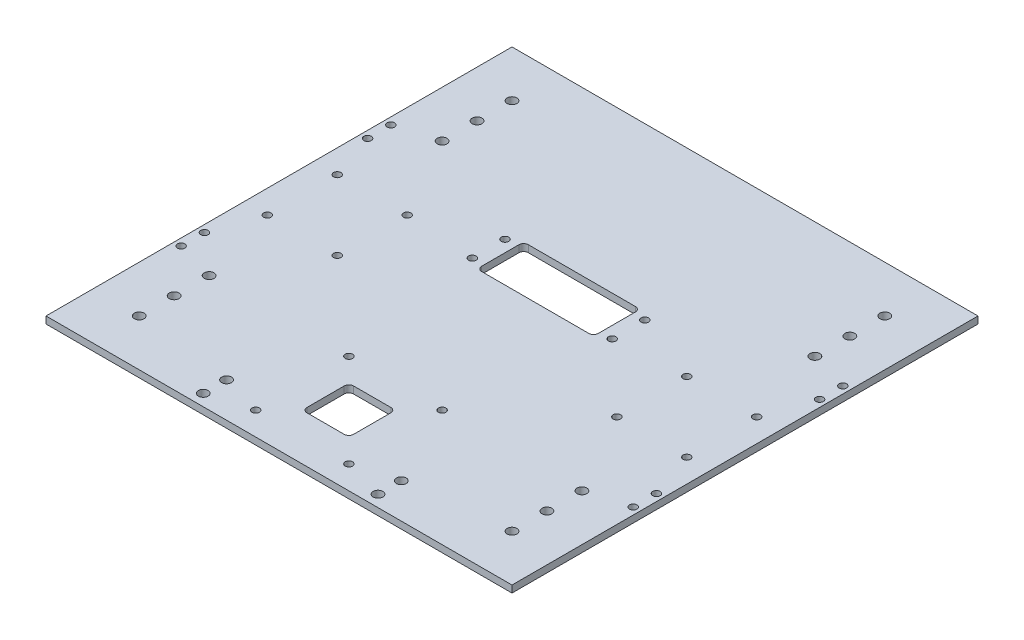
from build123d import *

# Parameters (mm, degrees)
SKETCH_1_W      = 200
SKETCH_1_H      = 200
SKETCH_1_R      = 1.6
SKETCH_1_R_2    = 2.1
EXTRUDE_1_DEPTH = 3


with BuildPart() as part:
    # 草图1 → 凸台-拉伸1 (new body)
    with BuildSketch(Plane(origin=(0, 0, 0), x_dir=(1, 0, 0), z_dir=(0, 1, 0))):
        Rectangle(SKETCH_1_W, SKETCH_1_H)
        with Locations(Location((-97, 35, 0), (0, 0, 270))):
            Circle(SKETCH_1_R, mode=Mode.SUBTRACT)
        with Locations(Location((-97, 45, 0), (0, 0, 270))):
            Circle(SKETCH_1_R, mode=Mode.SUBTRACT)
        with Locations(Location((-97, -45, 0), (0, 0, 90))):
            Circle(SKETCH_1_R, mode=Mode.SUBTRACT)
        with Locations(Location((-97, -35, 0), (0, 0, 90))):
            Circle(SKETCH_1_R, mode=Mode.SUBTRACT)
        with Locations(Location((97, -45, 0), (0, 0, 270))):
            Circle(SKETCH_1_R, mode=Mode.SUBTRACT)
        with Locations(Location((97, -35, 0), (0, 0, 270))):
            Circle(SKETCH_1_R, mode=Mode.SUBTRACT)
        with Locations(Location((97, 35, 0), (0, 0, 90))):
            Circle(SKETCH_1_R, mode=Mode.SUBTRACT)
        with Locations(Location((97, 45, 0), (0, 0, 90))):
            Circle(SKETCH_1_R, mode=Mode.SUBTRACT)
        with Locations(Location((-37.5, -95, 0), (0, 0, 270))):
            Circle(SKETCH_1_R_2, mode=Mode.SUBTRACT)
        with Locations(Location((-37.5, -85, 0), (0, 0, 270))):
            Circle(SKETCH_1_R_2, mode=Mode.SUBTRACT)
        with Locations(Location((37.5, -85, 0), (0, 0, 90))):
            Circle(SKETCH_1_R_2, mode=Mode.SUBTRACT)
        with Locations(Location((37.5, -95, 0), (0, 0, 90))):
            Circle(SKETCH_1_R_2, mode=Mode.SUBTRACT)
        with Locations(Location((-20, -50, 0), (0, 0, 270))):
            Circle(SKETCH_1_R, mode=Mode.SUBTRACT)
        with Locations(Location((20, -50, 0), (0, 0, 270))):
            Circle(SKETCH_1_R, mode=Mode.SUBTRACT)
        with Locations(Location((20, -90, 0), (0, 0, 270))):
            Circle(SKETCH_1_R, mode=Mode.SUBTRACT)
        with Locations(Location((-20, -90, 0), (0, 0, 270))):
            Circle(SKETCH_1_R, mode=Mode.SUBTRACT)
        with Locations(Location((-30, 27, 0), (0, 0, 270))):
            Circle(SKETCH_1_R, mode=Mode.SUBTRACT)
        with Locations(Location((-30, 13, 0), (0, 0, 270))):
            Circle(SKETCH_1_R, mode=Mode.SUBTRACT)
        with Locations(Location((30, 13, 0), (0, 0, 90))):
            Circle(SKETCH_1_R, mode=Mode.SUBTRACT)
        with Locations(Location((30, 27, 0), (0, 0, 90))):
            Circle(SKETCH_1_R, mode=Mode.SUBTRACT)
        with Locations(Location((-80, 50, 0), (0, 0, 270))):
            Circle(SKETCH_1_R_2, mode=Mode.SUBTRACT)
        with Locations(Location((-80, 65, 0), (0, 0, 270))):
            Circle(SKETCH_1_R_2, mode=Mode.SUBTRACT)
        with Locations(Location((-80, 80, 0), (0, 0, 270))):
            Circle(SKETCH_1_R_2, mode=Mode.SUBTRACT)
        with Locations(Location((80, 80, 0), (0, 0, 90))):
            Circle(SKETCH_1_R_2, mode=Mode.SUBTRACT)
        with Locations(Location((80, 65, 0), (0, 0, 90))):
            Circle(SKETCH_1_R_2, mode=Mode.SUBTRACT)
        with Locations(Location((80, 50, 0), (0, 0, 90))):
            Circle(SKETCH_1_R_2, mode=Mode.SUBTRACT)
        with Locations(Location((80, -80, 0), (0, 0, 270))):
            Circle(SKETCH_1_R_2, mode=Mode.SUBTRACT)
        with Locations(Location((80, -65, 0), (0, 0, 270))):
            Circle(SKETCH_1_R_2, mode=Mode.SUBTRACT)
        with Locations(Location((80, -50, 0), (0, 0, 270))):
            Circle(SKETCH_1_R_2, mode=Mode.SUBTRACT)
        with Locations(Location((-80, -80, 0), (0, 0, 90))):
            Circle(SKETCH_1_R_2, mode=Mode.SUBTRACT)
        with Locations(Location((-80, -65, 0), (0, 0, 90))):
            Circle(SKETCH_1_R_2, mode=Mode.SUBTRACT)
        with Locations(Location((-80, -50, 0), (0, 0, 90))):
            Circle(SKETCH_1_R_2, mode=Mode.SUBTRACT)
        with Locations(Location((-90, 15, 0), (0, 0, 270))):
            Circle(SKETCH_1_R, mode=Mode.SUBTRACT)
        with Locations(Location((-60, 15, 0), (0, 0, 270))):
            Circle(SKETCH_1_R, mode=Mode.SUBTRACT)
        with Locations(Location((-60, -15, 0), (0, 0, 270))):
            Circle(SKETCH_1_R, mode=Mode.SUBTRACT)
        with Locations(Location((-90, -15, 0), (0, 0, 270))):
            Circle(SKETCH_1_R, mode=Mode.SUBTRACT)
        with Locations(Location((90, -15, 0), (0, 0, 90))):
            Circle(SKETCH_1_R, mode=Mode.SUBTRACT)
        with Locations(Location((60, -15, 0), (0, 0, 90))):
            Circle(SKETCH_1_R, mode=Mode.SUBTRACT)
        with Locations(Location((60, 15, 0), (0, 0, 90))):
            Circle(SKETCH_1_R, mode=Mode.SUBTRACT)
        with Locations(Location((90, 15, 0), (0, 0, 90))):
            Circle(SKETCH_1_R, mode=Mode.SUBTRACT)
        with BuildLine():
            Line((-23, 10), (23, 10))
            ThreePointArc((23, 10), (24.414213562, 10.585786438), (25, 12))
            Line((25, 12), (25, 28))
            ThreePointArc((25, 28), (24.414213562, 29.414213562), (23, 30))
            Line((23, 30), (-23, 30))
            ThreePointArc((-23, 30), (-24.414213562, 29.414213562), (-25, 28))
            Line((-25, 28), (-25, 12))
            ThreePointArc((-25, 12), (-24.414213562, 10.585786438), (-23, 10))
        make_face(mode=Mode.SUBTRACT)
        with BuildLine():
            Line((-8, -80), (8, -80))
            ThreePointArc((8, -80), (9.414213562, -79.414213562), (10, -78))
            Line((10, -78), (10, -62))
            ThreePointArc((10, -62), (9.414213562, -60.585786438), (8, -60))
            Line((8, -60), (-8, -60))
            ThreePointArc((-8, -60), (-9.414213562, -60.585786438), (-10, -62))
            Line((-10, -62), (-10, -78))
            ThreePointArc((-10, -78), (-9.414213562, -79.414213562), (-8, -80))
        make_face(mode=Mode.SUBTRACT)
    extrude(amount=EXTRUDE_1_DEPTH)


solid = part.part
